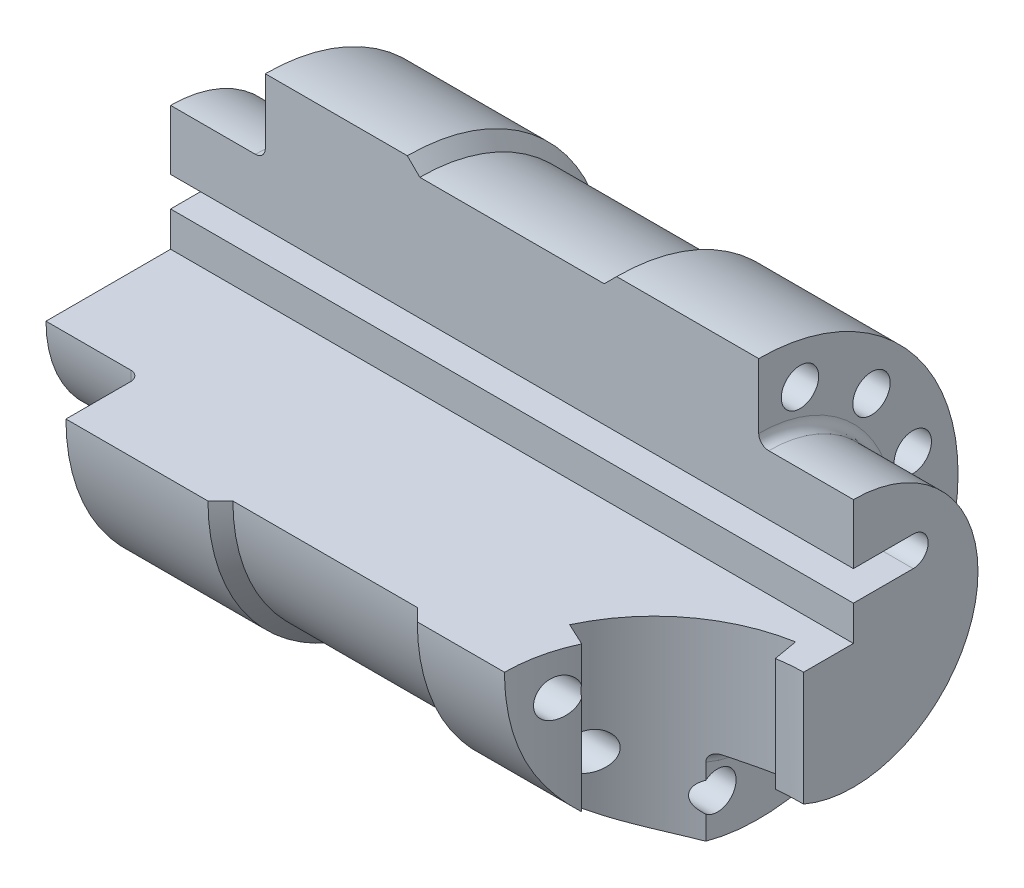
from build123d import *

# Parameters (mm, degrees)
ENL_V_MAT_EXTRU_1_DEPTH = 149.219431924
ESQUISSE3_R             = 3.75
ENL_V_MAT_EXTRU_2_DEPTH = 131.858702424
ENL_V_MAT_EXTRU_3_DEPTH = 126.862394907


with BuildPart() as part:
    # Esquisse1 → Révolution1 (revolve)
    with BuildSketch(Plane.XY, mode=Mode.PRIVATE) as r_volution1_sk:
        with BuildLine():
            Line((0, 0), (24.566275292, 0))
            Line((24.566275292, 0), (24.566275292, 25))
            Line((24.566275292, 25), (7.566275292, 25))
            ThreePointArc((7.566275292, 25), (6.152061729, 25.585786438), (5.566275292, 27))
            Line((5.566275292, 27), (5.566275292, 40))
            Line((5.566275292, 40), (-22.933724708, 40))
            Line((-22.933724708, 40), (-25.433724708, 37.5))
            Line((-25.433724708, 37.5), (-62.433724708, 37.5))
            Line((-62.433724708, 37.5), (-64.933724708, 40))
            Line((-64.933724708, 40), (-93.433724708, 40))
            Line((-93.433724708, 40), (-93.433724708, 27))
            ThreePointArc((-93.433724708, 27), (-94.019511146, 25.585786438), (-95.433724708, 25))
            Line((-95.433724708, 25), (-112.433724708, 25))
            Line((-112.433724708, 25), (-112.433724708, 0))
            Line((-112.433724708, 0), (0, 0))
        make_face()
    revolve(r_volution1_sk.sketch.rotate(Axis((-130.768922499, 0, 0), (1, 0, 0)), 90), axis=Axis((-130.768922499, 0, 0), (1, 0, 0)))

    # Esquisse2 → Enlèv. mat.-Extru.1 (cut, through all)
    with BuildSketch(Plane.ZY.offset(112.433724708)):
        with BuildLine():
            Line((0, 7), (0, 0))
            Line((0, 0), (43.449782835, 0))
            Line((43.449782835, 0), (43.449782835, 44.497429883))
            Line((43.449782835, 44.497429883), (0, 44.497429883))
            Line((0, 44.497429883), (0, 13))
            ThreePointArc((0, 13), (3, 10), (0, 7))
        make_face()
        with BuildLine():
            Line((-12, 7), (0, 7))
            ThreePointArc((0, 7), (3, 10), (0, 13))
            Line((0, 13), (-12, 13))
            ThreePointArc((-12, 13), (-15, 10), (-12, 7))
        make_face()
    extrude(amount=-ENL_V_MAT_EXTRU_1_DEPTH, mode=Mode.SUBTRACT)

    # Esquisse3 → Enlèv. mat.-Extru.2 (cut, through all)
    with BuildSketch(Plane.ZY.offset(93.433724708)):
        with Locations((-8.282209443, 30.909626441)):
            Circle(ESQUISSE3_R)
        with Locations((-22.627416998, 22.627416998)):
            Circle(ESQUISSE3_R)
        with Locations((-30.909626441, 8.282209443)):
            Circle(ESQUISSE3_R)
        with Locations((-30.909626441, -8.282209443)):
            Circle(ESQUISSE3_R)
        with Locations((-22.627416998, -22.627416998)):
            Circle(ESQUISSE3_R)
        with Locations((-8.282209443, -30.909626441)):
            Circle(ESQUISSE3_R)
        with Locations((8.282209443, -30.909626441)):
            Circle(ESQUISSE3_R)
        with Locations((22.627416998, -22.627416998)):
            Circle(ESQUISSE3_R)
        with Locations((30.909626441, -8.282209443)):
            Circle(ESQUISSE3_R)
    extrude(amount=-ENL_V_MAT_EXTRU_2_DEPTH, mode=Mode.SUBTRACT)

    # Esquisse4 → Enlèv. mat.-Extru.3 (cut, through all)
    with BuildSketch(Plane(origin=(0, 0, 0), x_dir=(1, 0, 0), z_dir=(0, 1, 0))):
        with BuildLine():
            Line((5.566275292, -31.140154495), (24.566275292, -40))
            Line((24.566275292, -40), (21.921370581, -25))
            Line((21.921370581, -25), (7.566275292, -25))
            ThreePointArc((7.566275292, -25), (6.152061729, -25.585786438), (5.566275292, -27))
            Line((5.566275292, -27), (5.566275292, -31.140154495))
        make_face()
        with BuildLine():
            Line((-5.433724708, -40), (5.566275292, -40))
            Line((5.566275292, -40), (5.566275292, -31.140154495))
            Line((5.566275292, -31.140154495), (-2.622958319, -27.321452148))
            ThreePointArc((-2.622958319, -27.321452148), (-4.722604922, -33.506811582), (-5.433724708, -40))
        make_face()
        with BuildLine():
            Line((-2.622958319, -27.321452148), (5.566275292, -31.140154495))
            Line((5.566275292, -31.140154495), (5.566275292, -27))
            ThreePointArc((5.566275292, -27), (6.152061729, -25.585786438), (7.566275292, -25))
            Line((7.566275292, -25), (21.921370581, -25))
            Line((21.921370581, -25), (19.356829962, -10.45576741))
            ThreePointArc((19.356829962, -10.45576741), (6.303432421, -16.199399791), (-2.622958319, -27.321452148))
        make_face()
        Polygon((5.566275292, -40), (24.566275292, -40), (5.566275292, -31.140154495), align=None)
        with BuildLine():
            Line((-7.154497255, -25.208360839), (-2.622958319, -27.321452148))
            ThreePointArc((-2.622958319, -27.321452148), (6.303432421, -16.199399791), (19.356829962, -10.45576741))
            Line((19.356829962, -10.45576741), (18.488589073, -5.531728645))
            ThreePointArc((18.488589073, -5.531728645), (3.259625276, -12.23263309), (-7.154497255, -25.208360839))
        make_face()
        with BuildLine():
            Line((21.921370581, -25), (24.566275292, -25))
            Line((24.566275292, -25), (24.566275292, -10))
            ThreePointArc((24.566275292, -10), (21.951603009, -10.114159057), (19.356829962, -10.45576741))
            Line((19.356829962, -10.45576741), (21.921370581, -25))
        make_face()
        Polygon((21.921370581, -25), (24.566275292, -40), (24.566275292, -25), align=None)
    extrude(amount=-ENL_V_MAT_EXTRU_3_DEPTH, mode=Mode.SUBTRACT)


solid = part.part
